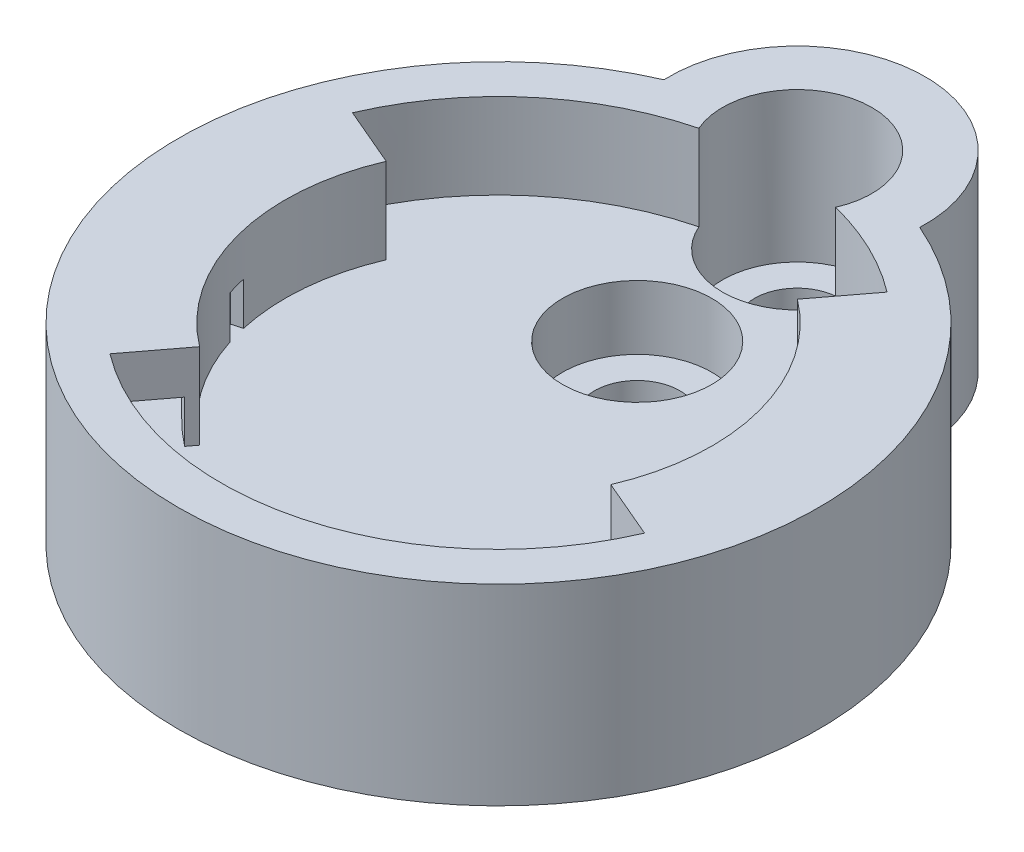
from build123d import *
from build123d.topology import SkipClean

# Parameters (mm, degrees)
SKIZZE1_R                       = 15
AUFSATZ_LINEAR_AUSTRAGEN1_DEPTH = 5
AUFSATZ_LINEAR_START            = 4
SKIZZE2_R                       = 15
SKIZZE2_R_2                     = 13
AUFSATZ_LINEAR_AUSTRAGEN2_DEPTH = 4
AUFSATZ_LINEAR_AUSTRAGEN3_DEPTH = 2
AUFSATZ_LINEAR_START_2          = 3
AUFSATZ_LINEAR_AUSTRAGEN6_DEPTH = 3
SKIZZE12_R                      = 2
SCHNITT_LINEAR_AUSTRAGEN1_DEPTH = 10
SKIZZE13_R                      = 3.5
SCHNITT_LINEAR_AUSTRAGEN2_DEPTH = 7
AUFSATZ_LINEAR_AUSTRAGEN7_DEPTH = 9
SKIZZE15_R                      = 3.5
SKIZZE15_R_2                    = 2
AUFSATZ_LINEAR_AUSTRAGEN8_DEPTH = 2


with BuildPart() as part:
    # Skizze1 → Aufsatz-Linear austragen1 (new body)
    with BuildSketch(Plane(origin=(0, 0, 0), x_dir=(1, 0, 0), z_dir=(0, 1, 0))):
        Circle(SKIZZE1_R)
    extrude(amount=-AUFSATZ_LINEAR_AUSTRAGEN1_DEPTH)

    # Skizze2 → Aufsatz-Linear austragen2 (add)
    with BuildSketch(Plane(origin=(0, 0, 0), x_dir=(1, 0, 0), z_dir=(0, 1, 0)).offset(AUFSATZ_LINEAR_START)):
        Circle(SKIZZE2_R)
        Circle(SKIZZE2_R_2, mode=Mode.SUBTRACT)
    extrude(amount=-AUFSATZ_LINEAR_AUSTRAGEN2_DEPTH)

    # Skizze3 → Aufsatz-Linear austragen3 (add)
    with BuildSketch(Plane(origin=(0, 4, 0), x_dir=(1, 0, 0), z_dir=(0, 1, 0))):
        with BuildLine():
            Line((-6.042078, -7.968268), (-7.854702, -10.358748))
            ThreePointArc((-7.854702, -10.358748), (-12.566291, -3.329914), (-11.953671, 5.109771))
            Line((-11.953671, 5.109771), (-9.195131, 3.930593))
            ThreePointArc((-9.195131, 3.930593), (-9.666378, -2.561472), (-6.042078, -7.968268))
        make_face()
        with BuildLine():
            Line((6.042078, 7.968268), (7.854702, 10.358748))
            ThreePointArc((7.854702, 10.358748), (12.566291, 3.329914), (11.953671, -5.109771))
            Line((11.953671, -5.109771), (9.195131, -3.930593))
            ThreePointArc((9.195131, -3.930593), (9.666378, 2.561472), (6.042078, 7.968268))
        make_face()
    extrude(amount=-AUFSATZ_LINEAR_AUSTRAGEN3_DEPTH)

    # Skizze11 → Aufsatz-Linear austragen6 (add)
    with BuildSketch(Plane(origin=(0, 0, 0), x_dir=(1, 0, 0), z_dir=(0, 1, 0)).offset(AUFSATZ_LINEAR_START_2)):
        with BuildLine():
            Line((-9.195131, 3.930593), (-9.654888, 4.127123))
            ThreePointArc((-9.654888, 4.127123), (-10.457571, 0.942977), (-10.237444, -2.333398))
            Line((-10.237444, -2.333398), (-9.755374, -2.198334))
            ThreePointArc((-9.755374, -2.198334), (-9.958481, 0.910302), (-9.195131, 3.930593))
        make_face()
        with BuildLine():
            Line((-9.512352, -3.084666), (-9.96953, -3.295219))
            ThreePointArc((-9.96953, -3.295219), (-8.541911, -6.106207), (-6.344182, -8.366681))
            Line((-6.344182, -8.366681), (-6.042078, -7.968268))
            ThreePointArc((-6.042078, -7.968268), (-8.151532, -5.792455), (-9.512352, -3.084666))
        make_face()
        with BuildLine():
            Line((6.344182, 8.366681), (6.042078, 7.968268))
            ThreePointArc((6.042078, 7.968268), (7.872714, 6.166066), (9.183817, 3.956957))
            Line((9.183817, 3.956957), (9.638169, 4.166018))
            ThreePointArc((9.638169, 4.166018), (8.262583, 6.479176), (6.344182, 8.366681))
        make_face()
        with BuildLine():
            Line((10.078818, 2.944049), (9.595423, 2.815647))
            ThreePointArc((9.595423, 2.815647), (9.982443, -0.592313), (9.195131, -3.930593))
            Line((9.195131, -3.930593), (9.654888, -4.127123))
            ThreePointArc((9.654888, -4.127123), (10.481181, -0.628367), (10.078818, 2.944049))
        make_face()
    extrude(amount=-AUFSATZ_LINEAR_AUSTRAGEN6_DEPTH)

    # Skizze12 → Schnitt-Linear austragen1 (cut)
    with BuildSketch(Plane(origin=(0, 0, 0), x_dir=(1, 0, 0), z_dir=(0, 1, 0))):
        with Locations((0, 6.5)):
            Circle(SKIZZE12_R)
        with Locations((0, 14)):
            Circle(SKIZZE12_R)
    extrude(amount=-SCHNITT_LINEAR_AUSTRAGEN1_DEPTH, mode=Mode.SUBTRACT)

    # Skizze13 → Schnitt-Linear austragen2 (cut)
    with BuildSketch(Plane(origin=(0, 4, 0), x_dir=(1, 0, 0), z_dir=(0, 1, 0))):
        with Locations((0, 14)):
            Circle(SKIZZE13_R)
        with Locations((0, 6.5)):
            Circle(SKIZZE13_R)
    extrude(amount=-SCHNITT_LINEAR_AUSTRAGEN2_DEPTH, mode=Mode.SUBTRACT)

    # Skizze14 → Aufsatz-Linear austragen7 (add)
    with SkipClean():  # the faces are left unmerged after this step: merging them gives an invalid solid
        with BuildSketch(Plane(origin=(0, 4, 0), x_dir=(1, 0, 0), z_dir=(0, 1, 0))):
            with BuildLine():
                Line((-5.994789, 13.75), (-3.448498, 14.598214))
                ThreePointArc((-3.448498, 14.598214), (0, 17.5), (3.448498, 14.598214))
                Line((3.448498, 14.598214), (5.994789, 13.75))
                ThreePointArc((5.994789, 13.75), (4.330127, 18.153312), (0, 20))
                ThreePointArc((0, 20), (-4.330127, 18.153312), (-5.994789, 13.75))
            make_face()
        extrude(amount=-AUFSATZ_LINEAR_AUSTRAGEN7_DEPTH)

    # Skizze15 → Aufsatz-Linear austragen8 (add)
    with BuildSketch(Plane(origin=(0, -3, 0), x_dir=(1, 0, 0), z_dir=(0, 1, 0))):
        with Locations((0, 14)):
            Circle(SKIZZE15_R)
        with Locations((0, 14)):
            Circle(SKIZZE15_R_2, mode=Mode.SUBTRACT)
    extrude(amount=-AUFSATZ_LINEAR_AUSTRAGEN8_DEPTH)


solid = part.part
